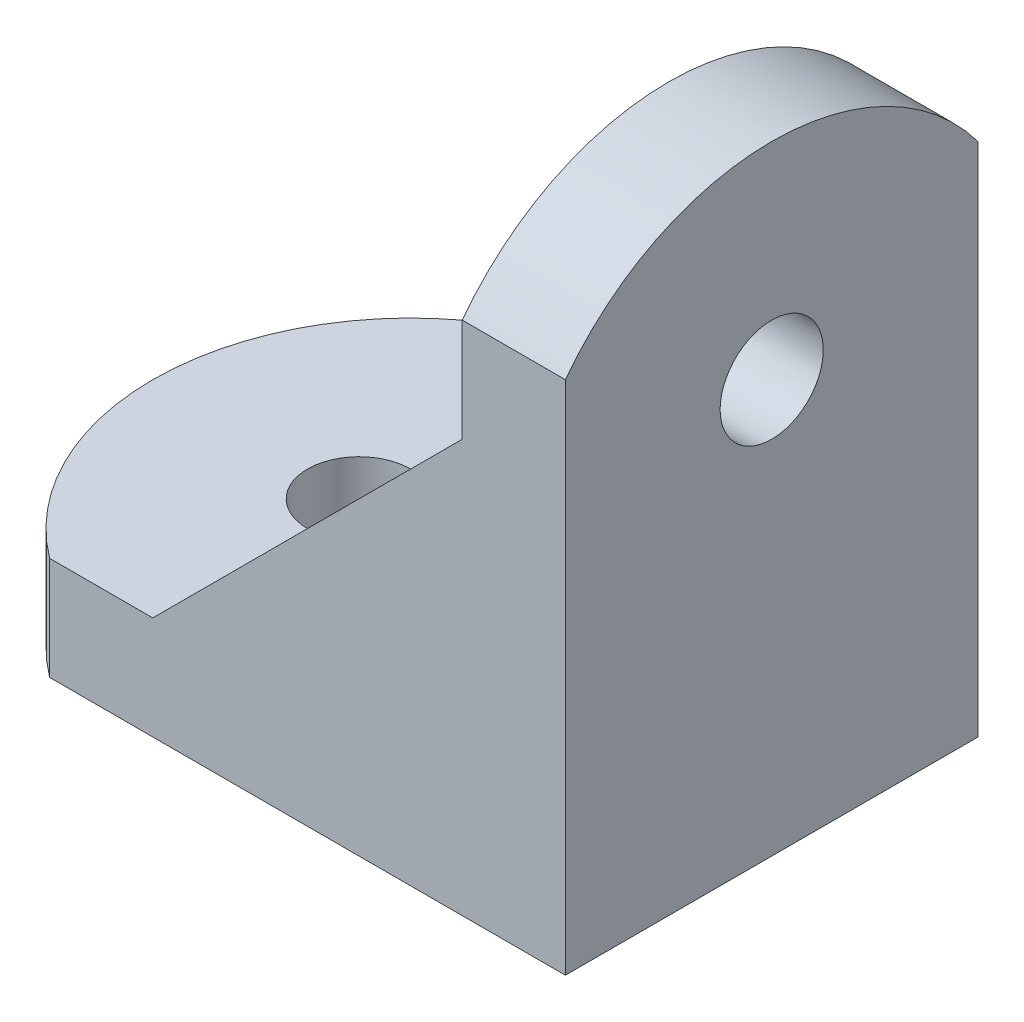
from build123d import *

# Parameters (mm, degrees)
SKETCH2_W           = 30
SKETCH2_H           = 20
BOSS_EXTRUDE1_DEPTH = 30
SKETCH3_W           = 25
SKETCH3_H           = 10
CUT_EXTRUDE1_DEPTH  = 25
CUT_EXTRUDE3_DEPTH  = 25
CUT_EXTRUDE4_DEPTH  = 25
CUT_EXTRUDE5_DEPTH  = 25
SKETCH7_R           = 2.5
CUT_EXTRUDE6_DEPTH  = 25
SKETCH8_R           = 2.5
CUT_EXTRUDE7_DEPTH  = 25


with BuildPart() as part:
    # Sketch2 → Boss-Extrude1 (new body)
    with BuildSketch(Plane(origin=(0, 0, 0), x_dir=(1, 0, 0), z_dir=(0, 1, 0))):
        with Locations((-6.999241769, 37.48522127)):
            Rectangle(SKETCH2_W, SKETCH2_H)
    extrude(amount=BOSS_EXTRUDE1_DEPTH)

    # Sketch3 → Cut-Extrude1 (cut)
    with BuildSketch(Plane(origin=(0, 30, 0), x_dir=(1, 0, 0), z_dir=(0, 1, 0))):
        with Locations((-9.499241769, 37.48522127)):
            Rectangle(SKETCH3_W, SKETCH3_H)
    extrude(amount=-CUT_EXTRUDE1_DEPTH, mode=Mode.SUBTRACT)

    # Sketch4 → Cut-Extrude3 (cut)
    with BuildSketch(Plane(origin=(0, 0, -47.48522127), x_dir=(-1, 0, 0), z_dir=(0, 0, -1))):
        Polygon((21.999241769, 30), (-3.000758231, 30), (-3.000758231, 20), (11.999241769, 5), (21.999241769, 5), align=None)
    extrude(amount=-CUT_EXTRUDE3_DEPTH, mode=Mode.SUBTRACT)

    # Sketch5 → Cut-Extrude4 (cut)
    with BuildSketch(Plane(origin=(8.000758231, 0, 0), x_dir=(0, 0, -1), z_dir=(1, 0, 0))):
        with BuildLine():
            Line((37.48522127, 30), (27.48522127, 30))
            Line((27.48522127, 30), (27.48522127, 25))
            ThreePointArc((27.48522127, 25), (31.895051326, 28.680339887), (37.48522127, 30))
        make_face()
        with BuildLine():
            Line((47.48522127, 30), (37.48522127, 30))
            ThreePointArc((37.48522127, 30), (43.075391214, 28.680339887), (47.48522127, 25))
            Line((47.48522127, 25), (47.48522127, 30))
        make_face()
    extrude(amount=-CUT_EXTRUDE4_DEPTH, mode=Mode.SUBTRACT)

    # Sketch6 → Cut-Extrude5 (cut)
    with BuildSketch(Plane.XZ):
        with BuildLine():
            Line((-16.999241769, -27.48522127), (-21.999241769, -27.48522127))
            Line((-21.999241769, -27.48522127), (-21.999241769, -37.485221231))
            ThreePointArc((-21.999241769, -37.485221231), (-20.679581647, -31.895051309), (-16.999241769, -27.48522127))
        make_face()
        with BuildLine():
            ThreePointArc((-16.999241769, -47.48522127), (-20.679581665, -43.075391196), (-21.999241769, -37.485221231))
            Line((-21.999241769, -37.485221231), (-21.999241769, -47.48522127))
            Line((-21.999241769, -47.48522127), (-16.999241769, -47.48522127))
        make_face()
    extrude(amount=-CUT_EXTRUDE5_DEPTH, mode=Mode.SUBTRACT)

    # Sketch7 → Cut-Extrude6 (cut)
    with BuildSketch(Plane(origin=(0, 5, 0), x_dir=(1, 0, 0), z_dir=(0, 1, 0))):
        with Locations(Location((-11.999241769, 37.48522127, 0), (0, 0, 270))):
            Circle(SKETCH7_R)
    extrude(amount=-CUT_EXTRUDE6_DEPTH, mode=Mode.SUBTRACT)

    # Sketch8 → Cut-Extrude7 (cut)
    with BuildSketch(Plane.ZY.offset(-3.000758231)):
        with Locations((-37.48522127, 20)):
            Circle(SKETCH8_R)
    extrude(amount=-CUT_EXTRUDE7_DEPTH, mode=Mode.SUBTRACT)


solid = part.part
